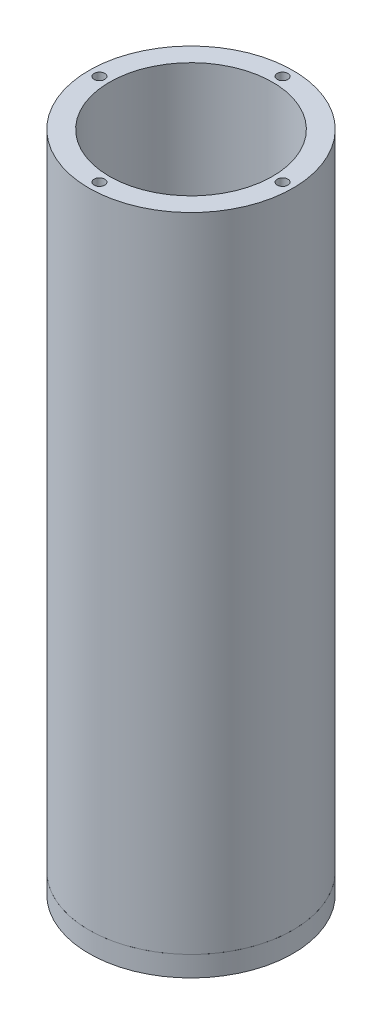
from build123d import *

# Parameters (mm, degrees)
SKETCH1_R                      = 31.75
SKETCH1_R_2                    = 25.4
BOSS_EXTRUDE1_DEPTH            = 200
SKETCH2_R                      = 31.75
BOSS_EXTRUDE2_DEPTH            = 6.35
M4X0_7_TAPPED_HOLE1_AT_2_COUNT = 2
M4X0_7_TAPPED_HOLE1_AT_2_PITCH = 40.305086528
M4X0_7_TAPPED_HOLE1_AT_3_COUNT = 2
M4X0_7_TAPPED_HOLE1_AT_3_PITCH = 57
M4X0_7_TAPPED_HOLE1_AT_4_COUNT = 2
M4X0_7_TAPPED_HOLE1_AT_4_PITCH = 40.305086528


with BuildPart() as part:
    # Sketch1 → Boss-Extrude1 (new body)
    with BuildSketch(Plane(origin=(0, 0, 0), x_dir=(1, 0, 0), z_dir=(0, 1, 0))):
        with Locations(Location((0, 0, 0), (0, 0, 270))):
            Circle(SKETCH1_R)
        with Locations(Location((0, 0, 0), (0, 0, 270))):
            Circle(SKETCH1_R_2, mode=Mode.SUBTRACT)
    extrude(amount=BOSS_EXTRUDE1_DEPTH)

    # Sketch3 → M4x0.7 Tapped Hole1 (revolve, cut)
    with BuildSketch(Plane(origin=(0, 200, -28.5), x_dir=(0, 0, 1), z_dir=(1, 0, 0))):
        Polygon((0, 0), (0, 11.091420021), (1.65, 10.1), (1.65, 0), align=None)
    m4x0_7_tapped_hole1 = revolve(axis=Axis((0, 206.35, -28.5), (0, -1, 0)), mode=Mode.SUBTRACT)

    # M4x0.7 Tapped Hole1 at 2: M4x0.7 Tapped Hole1 ×2
    with Locations(*[Vector(0.7071067811865476, 0, 0.7071067811865476) * (i * M4X0_7_TAPPED_HOLE1_AT_2_PITCH) for i in range(1, M4X0_7_TAPPED_HOLE1_AT_2_COUNT)]):
        add(m4x0_7_tapped_hole1, mode=Mode.SUBTRACT)

    # M4x0.7 Tapped Hole1 at 3: M4x0.7 Tapped Hole1 ×2
    with Locations(*[(0, 0, i * M4X0_7_TAPPED_HOLE1_AT_3_PITCH) for i in range(1, M4X0_7_TAPPED_HOLE1_AT_3_COUNT)]):
        add(m4x0_7_tapped_hole1, mode=Mode.SUBTRACT)

    # M4x0.7 Tapped Hole1 at 4: M4x0.7 Tapped Hole1 ×2
    with Locations(*[Vector(-0.7071067811865476, 0, 0.7071067811865476) * (i * M4X0_7_TAPPED_HOLE1_AT_4_PITCH) for i in range(1, M4X0_7_TAPPED_HOLE1_AT_4_COUNT)]):
        add(m4x0_7_tapped_hole1, mode=Mode.SUBTRACT)


with BuildPart() as body_2:
    # Sketch2 → Boss-Extrude2 (new body)
    with BuildSketch(Plane.XZ):
        with Locations(Location((0, 0, 0), (0, 0, 270))):
            Circle(SKETCH2_R)
    extrude(amount=BOSS_EXTRUDE2_DEPTH)


solid = Compound([part.part, body_2.part])
